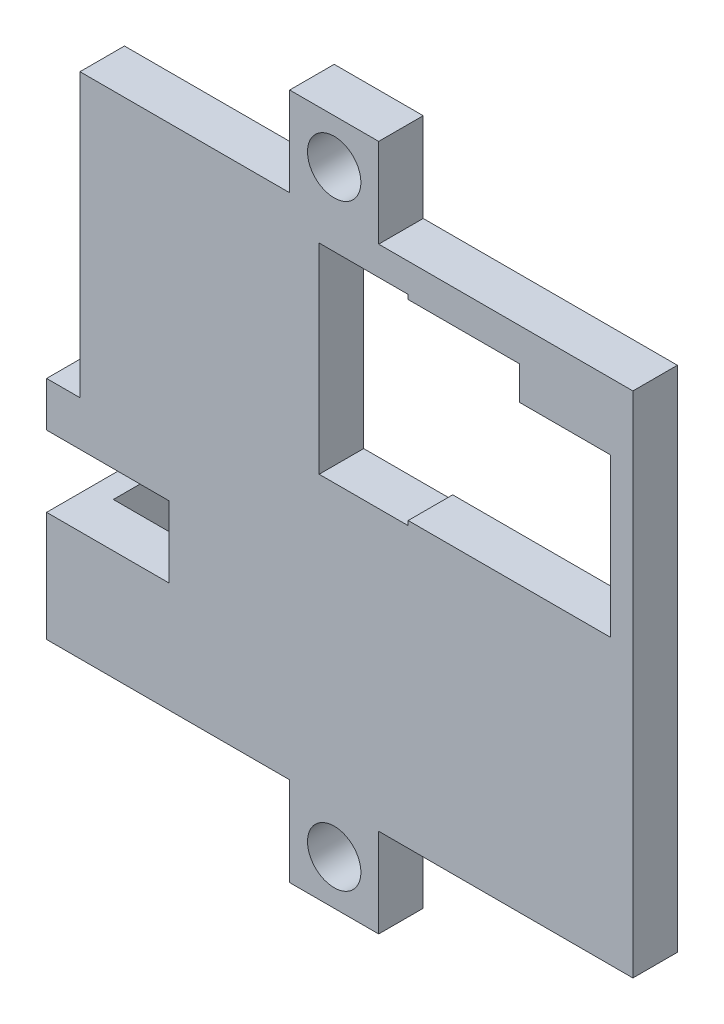
from build123d import *

# Parameters (mm, degrees)
SKETCH2_W            = 22.85
SKETCH2_H            = 22.85
BOSS_EXTRUDE1_DEPTH  = 2
SKETCH3_W            = 4
SKETCH3_H            = 4
BOSS_EXTRUDE2_DEPTH  = 2
M2_CLEARANCE_HOLE1_D = 2.4
CUT_EXTRUDE3_REACH   = 21.299
CUT_EXTRUDE4_REACH   = 21.299
SKETCH8_W            = 4
SKETCH8_H            = 3.2
SKETCH10_W           = 4.95
SKETCH10_H           = 2
SKETCH10_W_2         = 2.01114152
BOSS_EXTRUDE3_DEPTH  = 1.5
SKETCH11_W           = 1
SKETCH11_H           = 4.95
SKETCH11_H_2         = 2.01114152
BOSS_EXTRUDE4_DEPTH  = 4
SKETCH12_W           = 2.993624713
SKETCH12_H           = 2
SKETCH12_W_2         = 12.756375287
BOSS_EXTRUDE5_DEPTH  = 2
SKETCH13_W           = 1
SKETCH13_H           = 2
BOSS_EXTRUDE6_DEPTH  = 7.1
SKETCH15_R           = 1
BOSS_EXTRUDE7_DEPTH  = 2.5
CHAMFER1_SIZE        = 0.5


with BuildPart() as part:
    # Sketch2 → Boss-Extrude1 (new body)
    with BuildSketch(Plane(origin=(0, 0, 0), x_dir=(0, 1, 0), z_dir=(0, 0, 1))):
        Rectangle(SKETCH2_W, SKETCH2_H)
    extrude(amount=BOSS_EXTRUDE1_DEPTH)

    # Sketch3 → Boss-Extrude2 (add)
    with BuildSketch(Plane.XY.offset(2)):
        with Locations((0, 13.425)):
            Rectangle(SKETCH3_W, SKETCH3_H)
        with Locations((0, -13.425)):
            Rectangle(SKETCH3_W, SKETCH3_H)
    extrude(amount=-BOSS_EXTRUDE2_DEPTH)

    # M2 Clearance Hole1 (through all)
    with Locations(Plane.XY.offset(2)):
        with Locations((0, 13.425), (0, -13.425)):
            Hole(M2_CLEARANCE_HOLE1_D / 2)

    # Sketch7 → Cut-Extrude3 (cut, up to next)
    with BuildSketch(Plane.XY.offset(2), mode=Mode.PRIVATE) as cut_extrude3_sk1:
        Polygon((11.425, 8.431375287), (11.425, 1.331375287), (3.325, 1.331375287), (3.325, 1.131375287), (-0.675, 1.131375287), (-0.675, 10.131375287), (3.325, 10.131375287), (3.325, 9.931375287), (8.325, 9.931375287), (8.325, 8.431375287), align=None)
    cut_extrude3_tool1 = extrude(cut_extrude3_sk1.sketch, amount=-CUT_EXTRUDE3_REACH, mode=Mode.PRIVATE) & part.part
    add(cut_extrude3_tool1.solids().sort_by_distance((5.10369, 5.467951, 2))[0], mode=Mode.SUBTRACT)

    # Sketch8 → Cut-Extrude4 (cut, up to next)
    with BuildSketch(Plane.XY.offset(2), mode=Mode.PRIVATE) as cut_extrude4_sk1:
        with Locations((-9.425, -4.875)):
            Rectangle(SKETCH8_W, SKETCH8_H)
    cut_extrude4_tool1 = extrude(cut_extrude4_sk1.sketch, amount=-CUT_EXTRUDE4_REACH, mode=Mode.PRIVATE) & part.part
    add(cut_extrude4_tool1.solids().sort_by_distance((-9.425, -4.875, 2))[0], mode=Mode.SUBTRACT)

    # Sketch10 → Boss-Extrude3 (add)
    with BuildSketch(Plane(origin=(-11.425, 0, 0), x_dir=(0, -1, 0), z_dir=(-1, 0, 0))):
        with Locations((8.95, 1)):
            Rectangle(SKETCH10_W, SKETCH10_H)
        with Locations((2.26942924, 1)):
            Rectangle(SKETCH10_W_2, SKETCH10_H)
    extrude(amount=BOSS_EXTRUDE3_DEPTH)

    # Sketch11 → Boss-Extrude4 (add)
    with BuildSketch(Plane(origin=(0, 0, 0), x_dir=(1, 0, 0), z_dir=(0, 0, -1))):
        with Locations((-12.425, 8.95)):
            Rectangle(SKETCH11_W, SKETCH11_H)
        with Locations((-12.425, 2.26942924)):
            Rectangle(SKETCH11_W, SKETCH11_H_2)
    extrude(amount=BOSS_EXTRUDE4_DEPTH)

    # Sketch12 → Boss-Extrude5 (add)
    with BuildSketch(Plane.YZ.offset(11.425)):
        with Locations((9.928187643, 1)):
            Rectangle(SKETCH12_W, SKETCH12_H)
        with Locations((-5.046812357, 1)):
            Rectangle(SKETCH12_W_2, SKETCH12_H)
    extrude(amount=BOSS_EXTRUDE5_DEPTH)

    # Sketch13 → Boss-Extrude6 (add)
    with BuildSketch(Plane(origin=(0, 1.331375287, 0), x_dir=(-1, 0, 0), z_dir=(0, 1, 0))):
        with Locations((-12.925, 1)):
            Rectangle(SKETCH13_W, SKETCH13_H)
    extrude(amount=BOSS_EXTRUDE6_DEPTH)

    # Sketch15 → Boss-Extrude7 (add)
    with BuildSketch(Plane(origin=(0, 0, 0), x_dir=(1, 0, 0), z_dir=(0, 0, -1))):
        with Locations((-1.425, 4.875)):
            Circle(SKETCH15_R)
        with Locations((6.575, 4.875)):
            Circle(SKETCH15_R)
        with Locations((-7.425, -2.625)):
            Circle(SKETCH15_R)
    extrude(amount=BOSS_EXTRUDE7_DEPTH)

    # Chamfer1
    chamfer1_edges = [part.edges().sort_by_distance(p)[0] for p in [
        (-8.425, 2.625, -2.5),
        (5.575, -4.875, -2.5),
        (-2.425, -4.875, -2.5),
    ]]
    chamfer(chamfer1_edges, length=CHAMFER1_SIZE)


solid = part.part
